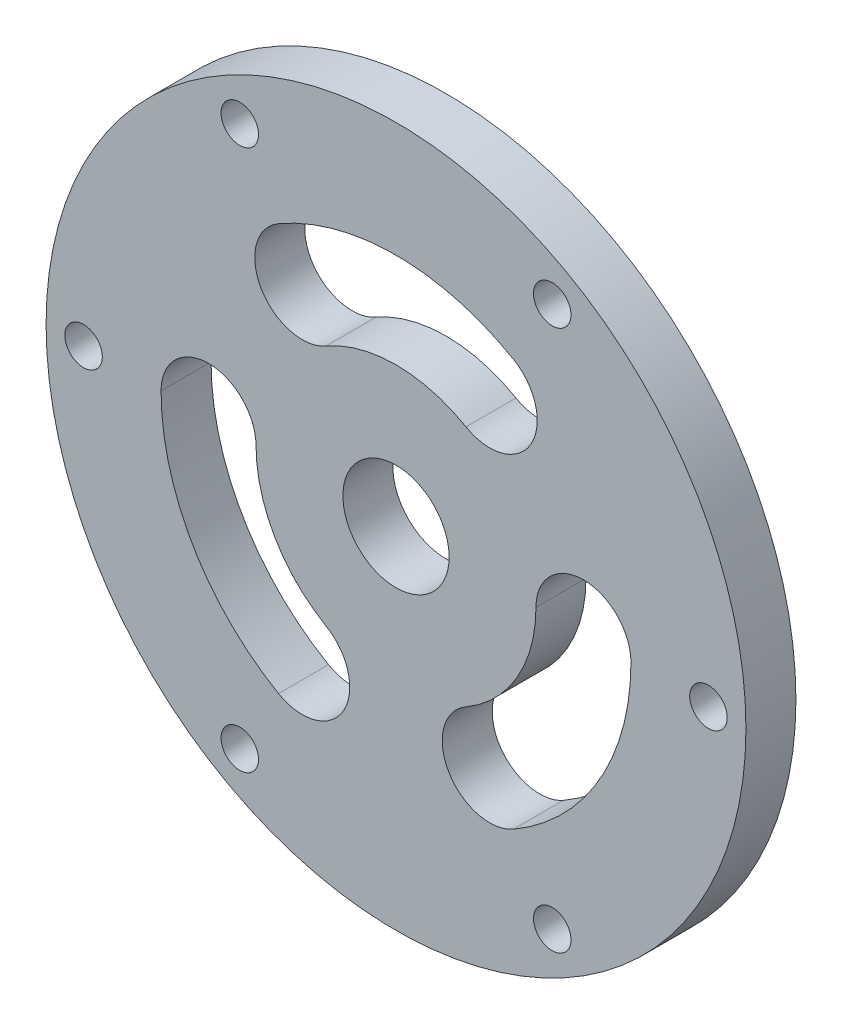
from build123d import *

# Parameters (mm, degrees)
SKETCH_1_R      = 28
SKETCH_1_R_2    = 4.25
SKETCH_1_R_3    = 1.5
EXTRUDE_1_DEPTH = 4


with BuildPart() as part:
    # 草图1 → 凸台-拉伸1 (new body)
    with BuildSketch(Plane.XY):
        Circle(SKETCH_1_R)
        Circle(SKETCH_1_R_2, mode=Mode.SUBTRACT)
        with Locations((12.5, 21.650635095)):
            Circle(SKETCH_1_R_3, mode=Mode.SUBTRACT)
        with Locations((25, 0)):
            Circle(SKETCH_1_R_3, mode=Mode.SUBTRACT)
        with Locations((12.5, -21.650635095)):
            Circle(SKETCH_1_R_3, mode=Mode.SUBTRACT)
        with Locations((-12.5, -21.650635095)):
            Circle(SKETCH_1_R_3, mode=Mode.SUBTRACT)
        with Locations((-25, 0)):
            Circle(SKETCH_1_R_3, mode=Mode.SUBTRACT)
        with Locations((-12.5, 21.650635095)):
            Circle(SKETCH_1_R_3, mode=Mode.SUBTRACT)
        with BuildLine():
            ThreePointArc((-11.2, 0), (-9.699484522, -5.6), (-5.6, -9.699484522))
            ThreePointArc((-5.6, -9.699484522), (-4.209103466, -14.890381057), (-9.4, -16.281277591))
            ThreePointArc((-9.4, -16.281277591), (-16.281277591, -9.4), (-18.8, 0))
            ThreePointArc((-18.8, 0), (-15, 3.8), (-11.2, 0))
        make_face(mode=Mode.SUBTRACT)
        with BuildLine():
            ThreePointArc((11.2, 0), (15, 3.8), (18.8, 0))
            ThreePointArc((18.8, 0), (16.281277591, -9.4), (9.4, -16.281277591))
            ThreePointArc((9.4, -16.281277591), (4.209103466, -14.890381057), (5.6, -9.699484522))
            ThreePointArc((5.6, -9.699484522), (9.699484522, -5.6), (11.2, 0))
        make_face(mode=Mode.SUBTRACT)
        with BuildLine():
            ThreePointArc((5.6, 9.699484522), (0, 11.2), (-5.6, 9.699484522))
            ThreePointArc((-5.6, 9.699484522), (-10.790896534, 11.090381057), (-9.4, 16.281277591))
            ThreePointArc((-9.4, 16.281277591), (0, 18.8), (9.4, 16.281277591))
            ThreePointArc((9.4, 16.281277591), (10.790896534, 11.090381057), (5.6, 9.699484522))
        make_face(mode=Mode.SUBTRACT)
    extrude(amount=EXTRUDE_1_DEPTH)


solid = part.part
